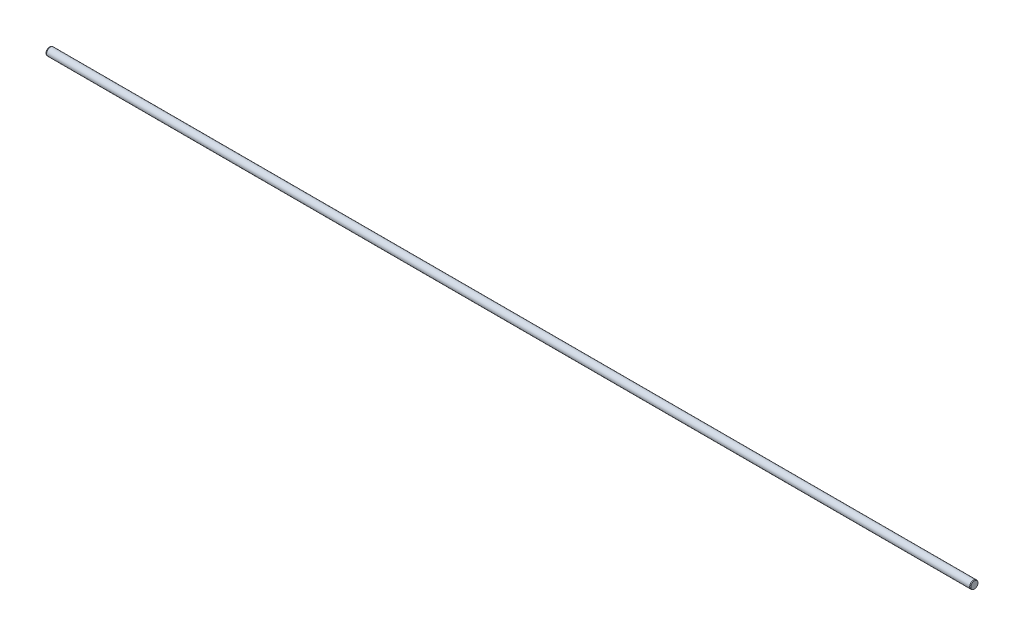
from build123d import *
from OCP.BRepFilletAPI import BRepFilletAPI_MakeChamfer

# Parameters (mm, degrees)
BOSS_EXTRUDE1_DEPTH      = 600
BOSS_EXTRUDE1_DEPTH_BACK = 600
SKETCH4_R                = 5
CHAMFER1_SIZE            = 0.3
CHAMFER1_SIZE2           = 1.119615242


with BuildPart() as part:
    # Sketch4 → Boss-Extrude1 (new, two sides: drawn at the far end of the back side and taken through both)
    with BuildSketch(Plane(origin=(0, 0, 0), x_dir=(0, 0, -1), z_dir=(1, 0, 0)).offset(-BOSS_EXTRUDE1_DEPTH_BACK)):
        Circle(SKETCH4_R)
    extrude(amount=BOSS_EXTRUDE1_DEPTH + BOSS_EXTRUDE1_DEPTH_BACK)

    # Chamfer1: one chamfer whose edges measure the first distance from different faces: ONE call of the kernel's chamfer builder (chamfer() names one face for all edges)
    chamfer1_edges_1 = [part.edges().sort_by_distance(p)[0] for p in [
        (-600, 0, 5),
    ]]
    chamfer1_side_1 = [part.faces().sort_by_distance(p)[0] for p in [
        (-600, 0, 0),
    ]]
    chamfer1_edges_2 = [part.edges().sort_by_distance(p)[0] for p in [
        (600, 0, 5),
    ]]
    chamfer1_side_2 = [part.faces().sort_by_distance(p)[0] for p in [
        (600, 0, 0),
    ]]
    chamfer1 = BRepFilletAPI_MakeChamfer(part.part.solid().wrapped)
    for e in chamfer1_edges_1:
        chamfer1.Add(CHAMFER1_SIZE, CHAMFER1_SIZE2, e.wrapped, chamfer1_side_1[0].wrapped)  # the first distance lies on this face
    for e in chamfer1_edges_2:
        chamfer1.Add(CHAMFER1_SIZE, CHAMFER1_SIZE2, e.wrapped, chamfer1_side_2[0].wrapped)  # the first distance lies on this face
    add(Compound.cast(chamfer1.Shape()), mode=Mode.REPLACE)


solid = part.part
